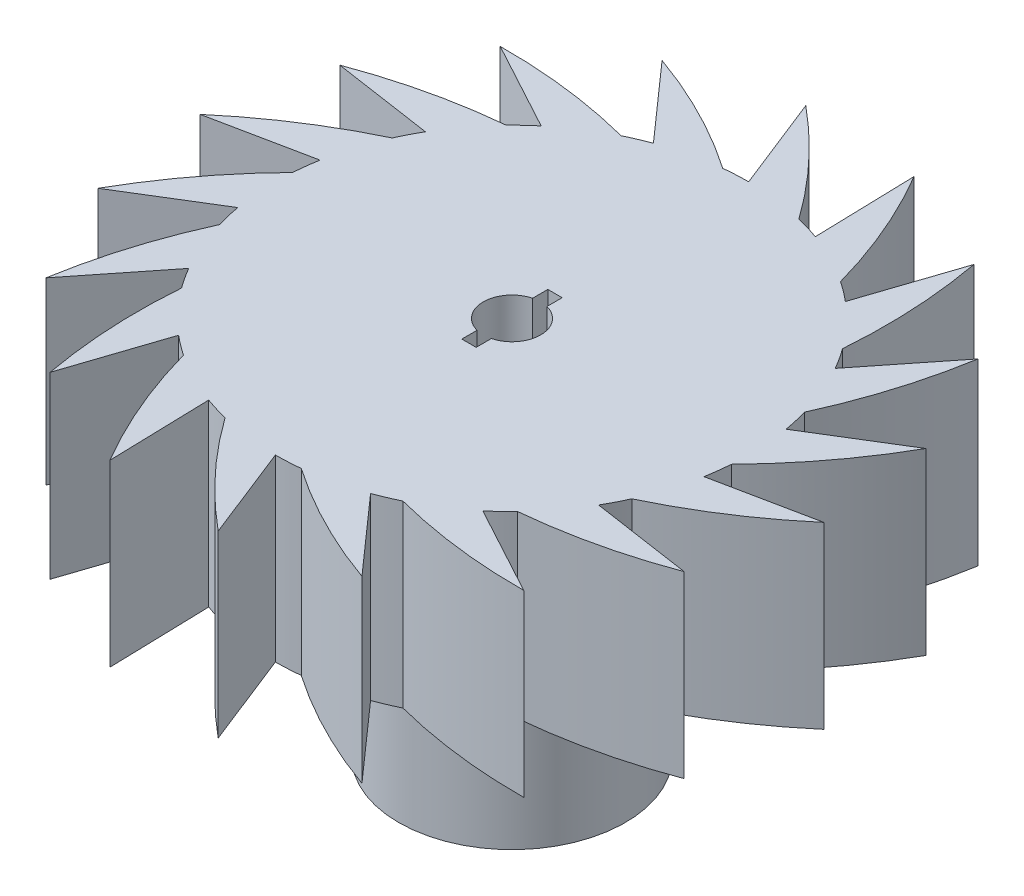
from build123d import *

# Parameters (mm, degrees)
SKETCH2_R           = 3.95
BOSS_EXTRUDE1_DEPTH = 13.25
SKETCH3_R           = 8.25
BOSS_EXTRUDE2_DEPTH = 6.25
CUT_EXTRUDE1_DEPTH  = 4
BOSS_EXTRUDE3_DEPTH = 6.25


with BuildPart() as part:
    # Sketch2 → Boss-Extrude1 (new body)
    with BuildSketch(Plane(origin=(0, 0, 0), x_dir=(1, 0, 0), z_dir=(0, 1, 0))):
        with Locations(Location((0, 0, 0), (0, 0, 270))):
            Circle(SKETCH2_R)
    extrude(amount=BOSS_EXTRUDE1_DEPTH)

    # Sketch3 → Boss-Extrude2 (add)
    with BuildSketch(Plane(origin=(0, 13.25, 0), x_dir=(1, 0, 0), z_dir=(0, 1, 0))):
        with Locations(Location((0, 0, 0), (0, 0, 270))):
            Circle(SKETCH3_R)
    extrude(amount=-BOSS_EXTRUDE2_DEPTH)

    # Sketch5 → Cut-Extrude1 (cut)
    with BuildSketch(Plane(origin=(0, 13.25, 0), x_dir=(1, 0, 0), z_dir=(0, 1, 0))):
        with BuildLine():
            Line((0.25, -0.968245837), (0.25, -1.5))
            Line((0.25, -1.5), (-0.25, -1.5))
            Line((-0.25, -1.5), (-0.25, -0.968245837))
            ThreePointArc((-0.25, -0.968245837), (-1, 0), (-0.25, 0.968245837))
            Line((-0.25, 0.968245837), (-0.25, 1.5))
            Line((-0.25, 1.5), (0.25, 1.5))
            Line((0.25, 1.5), (0.25, 0.968245837))
            ThreePointArc((0.25, 0.968245837), (1, 0), (0.25, -0.968245837))
        make_face()
    extrude(amount=-CUT_EXTRUDE1_DEPTH, mode=Mode.SUBTRACT)

    # Sketch4 → Boss-Extrude3 (add)
    with BuildSketch(Plane(origin=(0, 7, 0), x_dir=(1, 0, 0), z_dir=(0, 1, 0))):
        with BuildLine():
            Line((0, 8.25), (-1.301452207, 11.545140545))
            ThreePointArc((-1.301452207, 11.545140545), (0.465666366, 9.883034259), (2, 8.003905297))
            Line((2, 8.003905297), (0, 8.25))
        make_face()
        with BuildLine():
            Line((2.821666182, 7.752464121), (2.725705589, 11.294006247))
            ThreePointArc((2.725705589, 11.294006247), (3.817780042, 9.127747087), (4.616882078, 6.837170458))
            Line((4.616882078, 6.837170458), (2.821666182, 7.752464121))
        make_face()
        with BuildLine():
            Line((5.30299778, 6.319866656), (6.424103064, 9.680648113))
            ThreePointArc((6.424103064, 9.680648113), (6.7094131, 7.271518905), (6.67690004, 4.845771956))
            Line((6.67690004, 4.845771956), (5.30299778, 6.319866656))
        make_face()
        with BuildLine():
            Line((7.144709581, 4.125), (9.347658899, 6.899660946))
            ThreePointArc((9.347658899, 6.899660946), (8.791791918, 4.538238227), (7.931585317, 2.269901841))
            Line((7.931585317, 2.269901841), (7.144709581, 4.125))
        make_face()
        with BuildLine():
            Line((8.124663962, 1.432597466), (11.143749115, 3.28647284))
            ThreePointArc((11.143749115, 3.28647284), (9.813750878, 1.257579041), (8.229604346, -0.579751937))
            Line((8.229604346, -0.579751937), (8.124663962, 1.432597466))
        make_face()
        with BuildLine():
            Line((8.124663962, -1.432597466), (11.595738723, -0.723112393))
            ThreePointArc((11.595738723, -0.723112393), (9.652026646, -2.174762737), (7.535011635, -3.359479075))
            Line((7.535011635, -3.359479075), (8.124663962, -1.432597466))
        make_face()
        with BuildLine():
            Line((7.144709581, -4.125), (10.649111106, -4.6454796))
            ThreePointArc((10.649111106, -4.6454796), (8.326125552, -5.344796032), (5.931585317, -5.734003456))
            Line((5.931585317, -5.734003456), (7.144709581, -4.125))
        make_face()
        with BuildLine():
            Line((5.30299778, -6.319866656), (8.418043526, -8.007533407))
            ThreePointArc((8.418043526, -8.007533407), (5.995970836, -7.870168046), (3.612722268, -7.416922395))
            Line((3.612722268, -7.416922395), (5.30299778, -6.319866656))
        make_face()
        with BuildLine():
            Line((2.821666182, -7.752464121), (5.171635659, -10.403760506))
            ThreePointArc((5.171635659, -10.403760506), (2.942613546, -9.446281642), (0.858111595, -8.205251032))
            Line((0.858111595, -8.205251032), (2.821666182, -7.752464121))
        make_face()
        with BuildLine():
            Line((0, -8.25), (1.301452207, -11.545140545))
            ThreePointArc((1.301452207, -11.545140545), (-0.465666366, -9.883034259), (-2, -8.003905297))
            Line((-2, -8.003905297), (0, -8.25))
        make_face()
        with BuildLine():
            Line((-2.821666182, -7.752464121), (-2.725705589, -11.294006247))
            ThreePointArc((-2.725705589, -11.294006247), (-3.817780042, -9.127747087), (-4.616882078, -6.837170458))
            Line((-4.616882078, -6.837170458), (-2.821666182, -7.752464121))
        make_face()
        with BuildLine():
            Line((-5.30299778, -6.319866656), (-6.424103064, -9.680648113))
            ThreePointArc((-6.424103064, -9.680648113), (-6.7094131, -7.271518905), (-6.67690004, -4.845771956))
            Line((-6.67690004, -4.845771956), (-5.30299778, -6.319866656))
        make_face()
        with BuildLine():
            Line((-7.144709581, -4.125), (-9.347658899, -6.899660946))
            ThreePointArc((-9.347658899, -6.899660946), (-8.791791918, -4.538238227), (-7.931585317, -2.269901841))
            Line((-7.931585317, -2.269901841), (-7.144709581, -4.125))
        make_face()
        with BuildLine():
            Line((-8.124663962, -1.432597466), (-11.143749115, -3.28647284))
            ThreePointArc((-11.143749115, -3.28647284), (-9.813750878, -1.257579041), (-8.229604346, 0.579751937))
            Line((-8.229604346, 0.579751937), (-8.124663962, -1.432597466))
        make_face()
        with BuildLine():
            Line((-8.124663962, 1.432597466), (-11.595738723, 0.723112393))
            ThreePointArc((-11.595738723, 0.723112393), (-9.652026646, 2.174762737), (-7.535011635, 3.359479075))
            Line((-7.535011635, 3.359479075), (-8.124663962, 1.432597466))
        make_face()
        with BuildLine():
            Line((-7.144709581, 4.125), (-10.649111106, 4.6454796))
            ThreePointArc((-10.649111106, 4.6454796), (-8.326125552, 5.344796032), (-5.931585317, 5.734003456))
            Line((-5.931585317, 5.734003456), (-7.144709581, 4.125))
        make_face()
        with BuildLine():
            Line((-5.30299778, 6.319866656), (-8.418043526, 8.007533407))
            ThreePointArc((-8.418043526, 8.007533407), (-5.995970836, 7.870168046), (-3.612722268, 7.416922395))
            Line((-3.612722268, 7.416922395), (-5.30299778, 6.319866656))
        make_face()
        with BuildLine():
            Line((-2.821666182, 7.752464121), (-5.171635659, 10.403760506))
            ThreePointArc((-5.171635659, 10.403760506), (-2.942613546, 9.446281642), (-0.858111595, 8.205251032))
            Line((-0.858111595, 8.205251032), (-2.821666182, 7.752464121))
        make_face()
    extrude(amount=BOSS_EXTRUDE3_DEPTH)


solid = part.part
